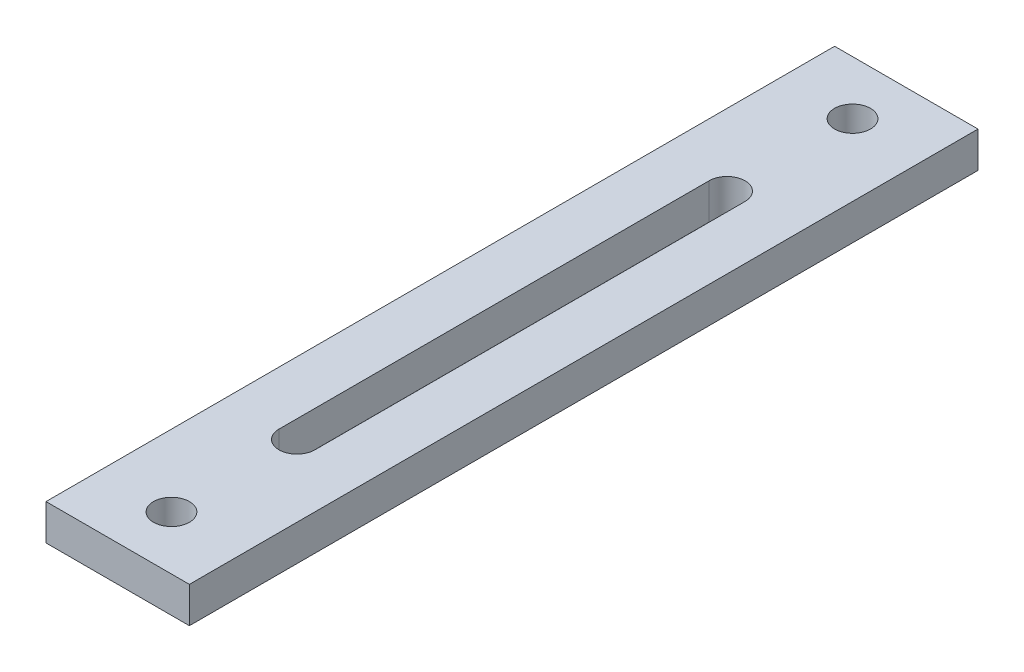
from build123d import *

# Parameters (mm, degrees)
SKETCH1_W           = 25.4
SKETCH1_H           = 139.7
SKETCH1_R           = 3.18262
BOSS_EXTRUDE1_DEPTH = 6.35


with BuildPart() as part:
    # Sketch1 → Boss-Extrude1 (new body)
    with BuildSketch(Plane(origin=(0, 0, 0), x_dir=(1, 0, 0), z_dir=(0, 1, 0))):
        Rectangle(SKETCH1_W, SKETCH1_H)
        with Locations(Location((0, 60.325, 0), (0, 0, 270))):
            Circle(SKETCH1_R, mode=Mode.SUBTRACT)
        with Locations(Location((0, -60.325, 0), (0, 0, 270))):
            Circle(SKETCH1_R, mode=Mode.SUBTRACT)
        with BuildLine():
            Line((-3.18262, -38.1), (-3.18262, 38.1))
            ThreePointArc((-3.18262, 38.1), (0, 41.28262), (3.18262, 38.1))
            Line((3.18262, 38.1), (3.18262, -38.1))
            ThreePointArc((3.18262, -38.1), (0, -41.28262), (-3.18262, -38.1))
        make_face(mode=Mode.SUBTRACT)
    extrude(amount=BOSS_EXTRUDE1_DEPTH)


solid = part.part
